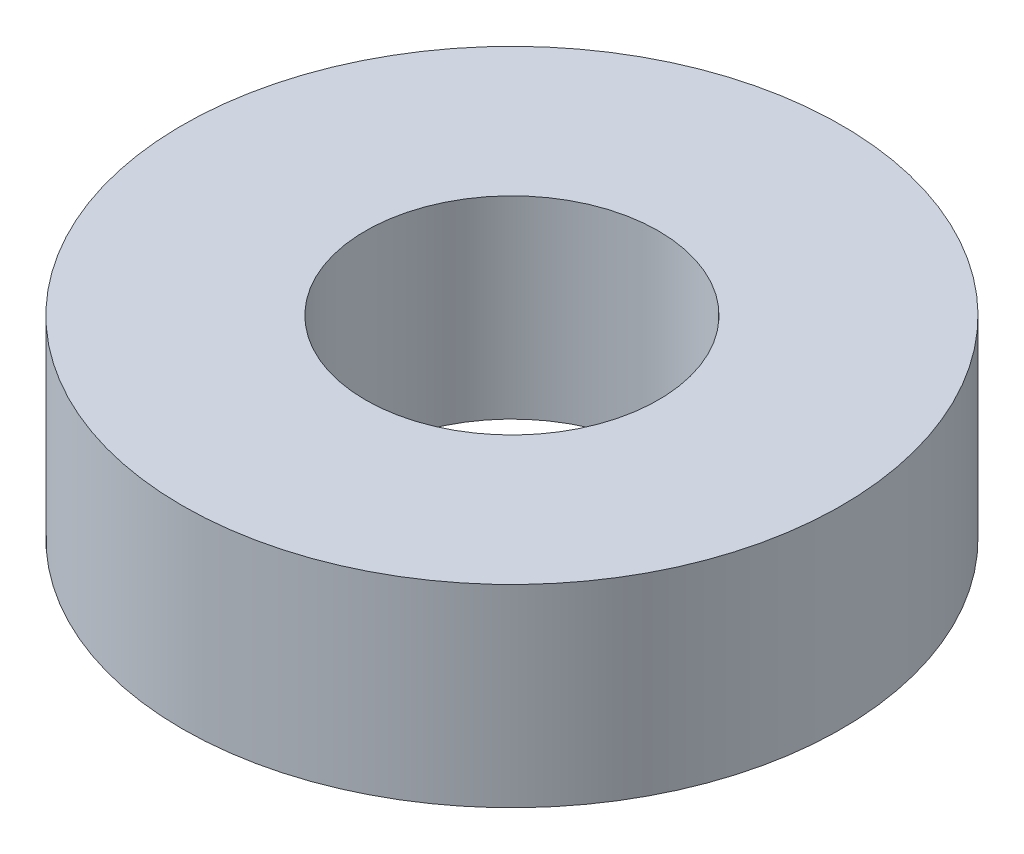
from build123d import *

# Parameters (mm, degrees)
SKETCH1_R           = 14.2875
SKETCH1_R_2         = 6.35
BOSS_EXTRUDE3_DEPTH = 8.382


with BuildPart() as part:
    # Sketch1 → Boss-Extrude3 (new body)
    with BuildSketch(Plane(origin=(0, 0, 0), x_dir=(1, 0, 0), z_dir=(0, 1, 0))):
        with Locations(Location((-18.156051425, 3.658536293, 0), (0, 0, 270))):
            Circle(SKETCH1_R)
        with Locations(Location((-18.156051425, 3.658536293, 0), (0, 0, 270))):
            Circle(SKETCH1_R_2, mode=Mode.SUBTRACT)
    extrude(amount=BOSS_EXTRUDE3_DEPTH)


solid = part.part
